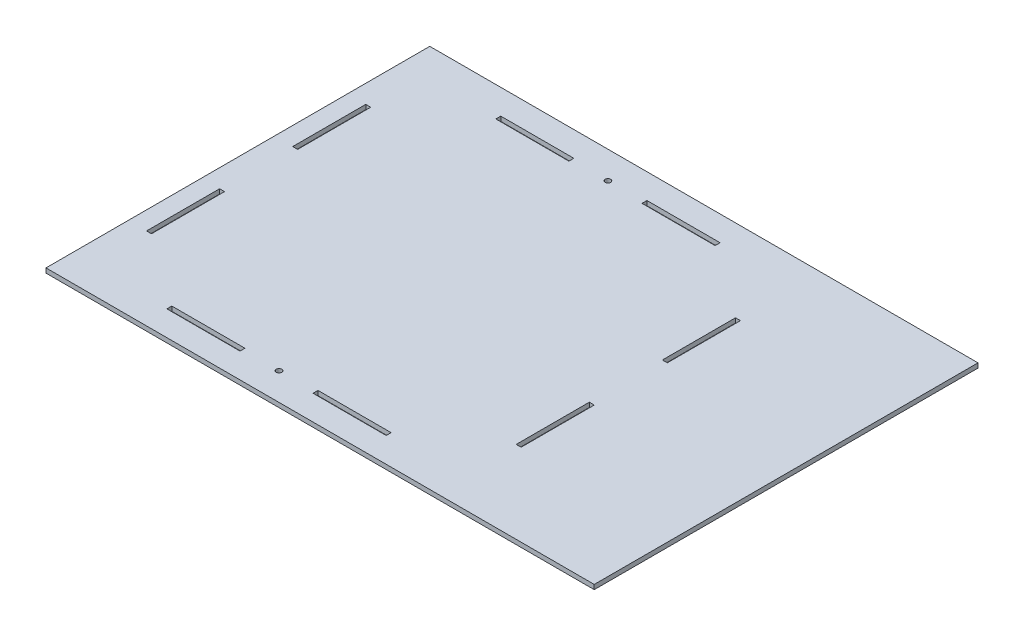
from build123d import *

# Parameters (mm, degrees)
SKETCH1_W           = 300
SKETCH1_H           = 210
BOSS_EXTRUDE1_DEPTH = 2.5
SKETCH4_W           = 2.7
SKETCH4_H           = 40
SKETCH4_W_2         = 40
SKETCH4_H_2         = 2.7
SKETCH4_R           = 1.5
CUT_EXTRUDE1_DEPTH  = 2.5


with BuildPart() as part:
    # Sketch1 → Boss-Extrude1 (new body)
    with BuildSketch(Plane(origin=(0, 0, 0), x_dir=(1, 0, 0), z_dir=(0, 1, 0))):
        Rectangle(SKETCH1_W, SKETCH1_H)
    extrude(amount=BOSS_EXTRUDE1_DEPTH)

    # Sketch4 → Cut-Extrude1 (cut)
    with BuildSketch(Plane(origin=(0, 2.5, 0), x_dir=(1, 0, 0), z_dir=(0, 1, 0))):
        with Locations((-138.65, 40)):
            Rectangle(SKETCH4_W, SKETCH4_H)
        with Locations((-138.65, -40)):
            Rectangle(SKETCH4_W, SKETCH4_H)
        with Locations((-77.5, -90)):
            Rectangle(SKETCH4_W_2, SKETCH4_H_2)
        with Locations(Location((-37.5, -90, 0), (0, 0, 270))):
            Circle(SKETCH4_R)
        with Locations((2.5, -90)):
            Rectangle(SKETCH4_W_2, SKETCH4_H_2)
        with Locations((63.65, 40)):
            Rectangle(SKETCH4_W, SKETCH4_H)
        with Locations((63.65, -40)):
            Rectangle(SKETCH4_W, SKETCH4_H)
        with Locations(Location((-37.5, 90, 0), (0, 0, 270))):
            Circle(SKETCH4_R)
        with Locations((-77.5, 90)):
            Rectangle(SKETCH4_W_2, SKETCH4_H_2)
        with Locations((2.5, 90)):
            Rectangle(SKETCH4_W_2, SKETCH4_H_2)
    extrude(amount=-CUT_EXTRUDE1_DEPTH, mode=Mode.SUBTRACT)


solid = part.part
